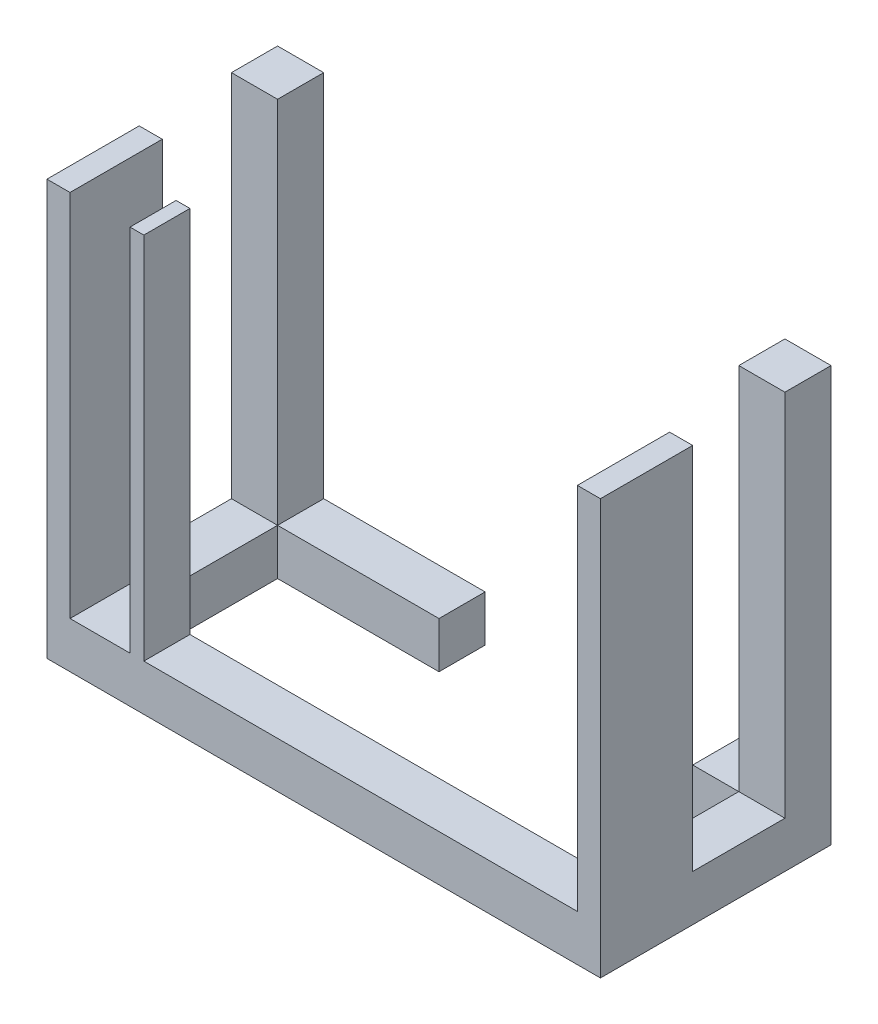
from build123d import *

# Parameters (mm, degrees)
SKETCH_1_W          = 120
SKETCH_1_H          = 50
SKETCH_1_W_2        = 100
SKETCH_1_H_2        = 30
EXTRUDE_1_DEPTH     = 10
SKETCH_2_W          = 5
SKETCH_2_H          = 20
SKETCH_2_W_2        = 10
SKETCH_2_H_2        = 10
SKETCH_2_W_3        = 3
EXTRUDE_2_DEPTH     = 80
SKETCH_3_W          = 55
SKETCH_3_H          = 10
CUT_EXTRUDE_1_DEPTH = 112.018016556


with BuildPart() as part:
    # 草图1 → 凸台-拉伸1 (new body)
    with BuildSketch(Plane(origin=(0, 0, 0), x_dir=(1, 0, 0), z_dir=(0, 1, 0))):
        Rectangle(SKETCH_1_W, SKETCH_1_H)
        Rectangle(SKETCH_1_W_2, SKETCH_1_H_2, mode=Mode.SUBTRACT)
    extrude(amount=EXTRUDE_1_DEPTH)

    # 草图2 → 凸台-拉伸2 (add)
    with BuildSketch(Plane(origin=(0, 10, 0), x_dir=(1, 0, 0), z_dir=(0, 1, 0))):
        with Locations((57.5, -15)):
            Rectangle(SKETCH_2_W, SKETCH_2_H)
        with Locations((-57.5, -15)):
            Rectangle(SKETCH_2_W, SKETCH_2_H)
        with Locations((-55, 20)):
            Rectangle(SKETCH_2_W_2, SKETCH_2_H_2)
        with Locations((55, 20)):
            Rectangle(SKETCH_2_W_2, SKETCH_2_H_2)
        with Locations((-40.5, -20)):
            Rectangle(SKETCH_2_W_3, SKETCH_2_H_2)
    extrude(amount=EXTRUDE_2_DEPTH)

    # 草图3 → 切除-拉伸1 (cut, through all)
    with BuildSketch(Plane.XZ):
        with Locations((12.5, -20)):
            Rectangle(SKETCH_3_W, SKETCH_3_H)
    extrude(amount=-CUT_EXTRUDE_1_DEPTH, mode=Mode.SUBTRACT)


solid = part.part
